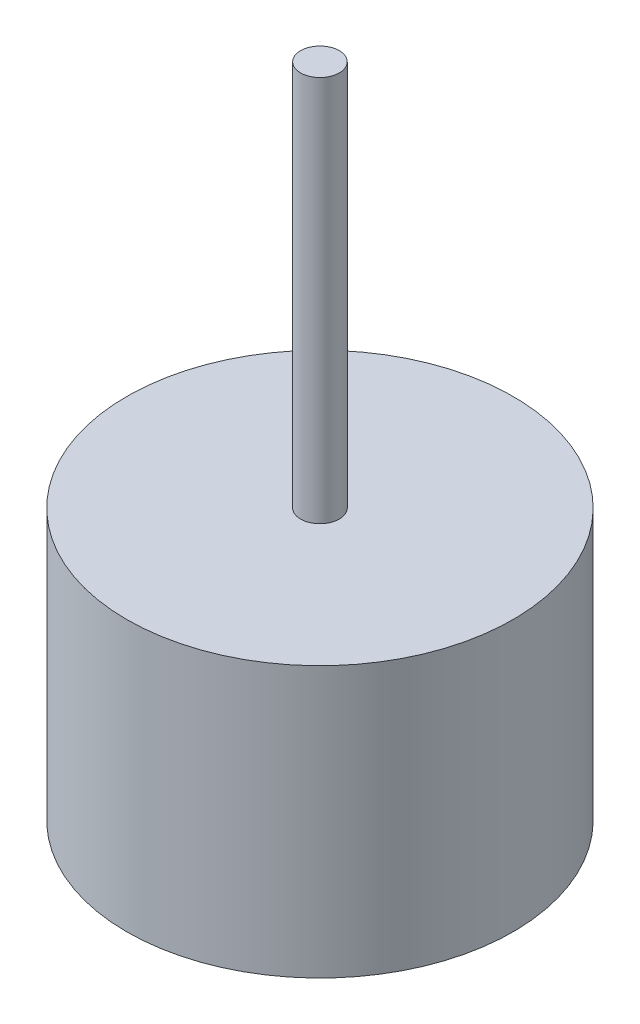
from build123d import *

# Parameters (mm, degrees)
SKETCH1_R           = 5
BOSS_EXTRUDE1_DEPTH = 7
SKETCH2_R           = 0.5
BOSS_EXTRUDE2_DEPTH = 10


with BuildPart() as part:
    # Sketch1 → Boss-Extrude1 (new body)
    with BuildSketch(Plane(origin=(0, 0, 0), x_dir=(1, 0, 0), z_dir=(0, 1, 0))):
        with Locations(Location((0, 0, 0), (0, 0, 270))):
            Circle(SKETCH1_R)
    extrude(amount=BOSS_EXTRUDE1_DEPTH)

    # Sketch2 → Boss-Extrude2 (add)
    with BuildSketch(Plane(origin=(0, 7, 0), x_dir=(-1, 0, 0), z_dir=(0, 1, 0))):
        with Locations(Location((0, 0, 0), (0, 0, 90))):
            Circle(SKETCH2_R)
    extrude(amount=BOSS_EXTRUDE2_DEPTH)


solid = part.part
